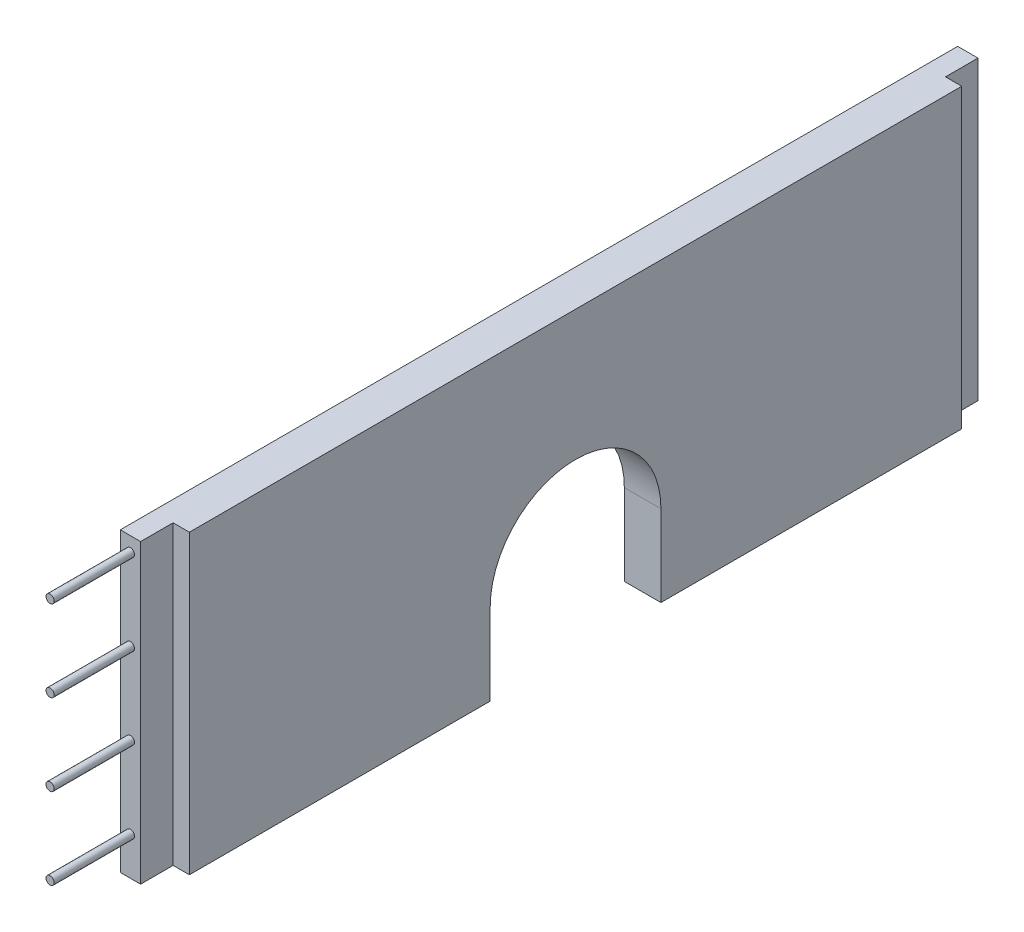
from build123d import *

# Parameters (mm, degrees)
SKETCH_1_W          = 2.5
SKETCH_1_H          = 103
SKETCH_1_W_2        = 2
SKETCH_1_H_2        = 95
EXTRUDE_1_DEPTH     = 99.5
CUT_EXTRUDE_2_DEPTH = 4.5
CUT_EXTRUDE_3_DEPTH = 58.5
CUT_EXTRUDE_4_DEPTH = 4.5
SKETCH_6_W          = 1.6
SKETCH_6_H          = 17
CUT_EXTRUDE_5_DEPTH = 10
SKETCH_7_R          = 0.5
EXTRUDE_2_DEPTH     = 9.886463591


with BuildPart() as part:
    # 스케치1 → 보스-돌출1 (new body)
    with BuildSketch(Plane(origin=(0, 0, 0), x_dir=(1, 0, 0), z_dir=(0, 1, 0))):
        with Locations((1.25, -51.5)):
            Rectangle(SKETCH_1_W, SKETCH_1_H)
        with Locations((3.5, -51.5)):
            Rectangle(SKETCH_1_W_2, SKETCH_1_H_2)
    extrude(amount=EXTRUDE_1_DEPTH)

    # 스케치2 → 컷-돌출2 (cut)
    with BuildSketch(Plane(origin=(4.5, 0, 0), x_dir=(0, 0, -1), z_dir=(1, 0, 0))):
        with BuildLine():
            Line((-62, 10), (-62, 0))
            Line((-62, 0), (-41, 0))
            Line((-41, 0), (-41, 10))
            ThreePointArc((-41, 10), (-51.5, 20.5), (-62, 10))
        make_face()
    extrude(amount=-CUT_EXTRUDE_2_DEPTH, mode=Mode.SUBTRACT)

    # 스케치3 → 컷-돌출3 (cut)
    with BuildSketch(Plane(origin=(0, 99.5, 0), x_dir=(1, 0, 0), z_dir=(0, 1, 0))):
        Polygon((2.5, -4), (2.5, 0), (0, 0), (0, -103), (2.5, -103), (2.5, -99), (4.5, -99), (4.5, -4), align=None)
    extrude(amount=-CUT_EXTRUDE_3_DEPTH, mode=Mode.SUBTRACT)

    # 스케치4 → 컷-돌출4 (cut)
    with BuildSketch(Plane(origin=(0, 41, 0), x_dir=(1, 0, 0), z_dir=(0, 1, 0))):
        Polygon((4.5, -4), (2.5, -4), (2.5, 0), (0, 0), (0, -103), (2.5, -103), (2.5, -99), (4.5, -99), align=None)
    extrude(amount=-CUT_EXTRUDE_4_DEPTH, mode=Mode.SUBTRACT)

    # 스케치6 → 컷-돌출5 (cut)
    with BuildSketch(Plane.XZ):
        with Locations((0.8, 74)):
            Rectangle(SKETCH_6_W, SKETCH_6_H)
    extrude(amount=-CUT_EXTRUDE_5_DEPTH, mode=Mode.SUBTRACT)

    # 스케치7 → 보스-돌출2 (add)
    with BuildSketch(Plane.XY.offset(103)):
        with Locations(Location((1.25, 34.722848579, 0), (0, 0, 180))):
            Circle(SKETCH_7_R)
        with Locations(Location((1.25, 24.722848579, 0), (0, 0, 180))):
            Circle(SKETCH_7_R)
        with Locations(Location((1.25, 14.722848579, 0), (0, 0, 180))):
            Circle(SKETCH_7_R)
        with Locations(Location((1.25, 4.722848579, 0), (0, 0, 180))):
            Circle(SKETCH_7_R)
    extrude(amount=EXTRUDE_2_DEPTH)


solid = part.part
